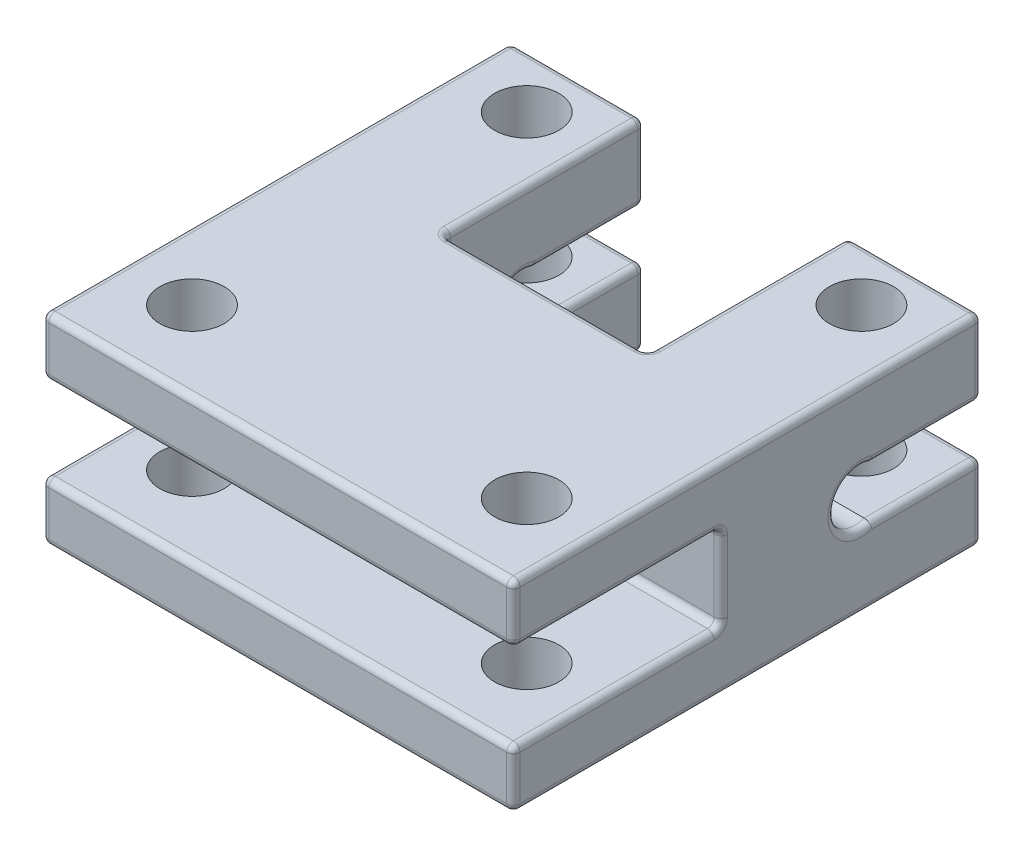
from build123d import *

# Parameters (mm, degrees)
BOSS_EXTRU_1_DEPTH = 10
BOSS_EXTRU_2_DEPTH = 7.6
D_GAGEMENT_M41_D   = 4.8
CONG_1_R           = 0.5


with BuildPart() as part:
    # Esquisse2 → Boss.-Extru.1 (new body)
    with BuildSketch(Plane(origin=(0, 0, 0), x_dir=(0, 0, -1), z_dir=(1, 0, 0))):
        with BuildLine():
            Line((35, 0), (0, 0))
            Line((0, 0), (0, -4.325))
            Line((0, -4.325), (15.5, -4.325))
            Line((15.5, -4.325), (15.5, -10.675))
            Line((15.5, -10.675), (0, -10.675))
            Line((0, -10.675), (0, -15))
            Line((0, -15), (35, -15))
            Line((35, -15), (35, -9.375))
            Line((35, -9.375), (26.695970545, -9.375))
            ThreePointArc((26.695970545, -9.375), (24, -7.5), (26.695970545, -5.625))
            Line((26.695970545, -5.625), (35, -5.625))
            Line((35, -5.625), (35, 0))
        make_face()
    extrude(amount=BOSS_EXTRU_1_DEPTH)

    # Esquisse3 → Boss.-Extru.2 (add)
    with BuildSketch(Plane.ZY):
        Polygon((0, 0), (0, -4.325), (-15.5, -4.325), (-15.5, -10.675), (0, -10.675), (0, -15), (-20, -15), (-20, 0), align=None)
    extrude(amount=BOSS_EXTRU_2_DEPTH)

    # Symétrie5: part across plane


with BuildPart() as part_1:
    add(part.part)
    add(part.part.mirror(Plane(origin=(-7.6, 0, 0), x_dir=(0, 0, 1), z_dir=(1, 0, 0))))

    # Dégagement M41 (through all)
    with Locations(Plane(origin=(0, 0, 0), x_dir=(1, 0, 0), z_dir=(0, 1, 0))):
        with Locations((5, 6), (-20, 6), (5, 31), (-20, 31)):
            Hole(D_GAGEMENT_M41_D / 2)

    # Congé1
    cong_1_edges = [part_1.edges().sort_by_distance(p)[0] for p in [
        (10, -2.1625, 0),
        (0, -5.625, -30.847985273),
        (0, -7.5, -24),
        (0, -9.375, -30.847985273),
        (0, -12.1875, -35),
        (10, -4.325, -7.75),
        (0, 0, -27.5),
        (0, -2.8125, -35),
        (10, -7.5, -15.5),
        (10, -10.675, -7.75),
        (5, -5.625, -35),
        (5, -9.375, -35),
        (5, -15, -35),
        (-7.6, -15, 0),
        (-7.6, -10.675, 0),
        (-7.6, -10.675, -15.5),
        (-7.6, -4.325, -15.5),
        (-7.6, -4.325, 0),
        (-7.6, 0, 0),
        (5, 0, -35),
        (10, -12.8375, 0),
        (10, -15, -17.5),
        (10, -12.1875, -35),
        (10, -9.375, -30.847985273),
        (0, -15, -27.5),
        (10, -7.5, -24),
        (0, -7.5, -20),
        (-7.6, 0, -20),
        (-7.6, -15, -20),
        (10, -5.625, -30.847985273),
        (10, -2.8125, -35),
        (-25.2, -2.8125, -35),
        (-20.2, 0, -35),
        (-25.2, 0, -17.5),
        (-25.2, -2.1625, 0),
        (-25.2, -4.325, -7.75),
        (-25.2, -7.5, -15.5),
        (-25.2, -10.675, -7.75),
        (-25.2, -12.8375, 0),
        (-25.2, -15, -17.5),
        (-20.2, -15, -35),
        (-25.2, -12.1875, -35),
        (-20.2, -9.375, -35),
        (-25.2, -9.375, -30.847985273),
        (-25.2, -7.5, -24),
        (-25.2, -5.625, -30.847985273),
        (-20.2, -5.625, -35),
        (-15.2, -7.5, -20),
        (-15.2, -15, -27.5),
        (-15.2, -12.1875, -35),
        (-15.2, -9.375, -30.847985273),
        (-15.2, -7.5, -24),
        (-15.2, -5.625, -30.847985273),
        (-15.2, -2.8125, -35),
        (-15.2, 0, -27.5),
        (10, 0, -17.5),
    ]]
    fillet(cong_1_edges, radius=CONG_1_R)


solid = part_1.part
